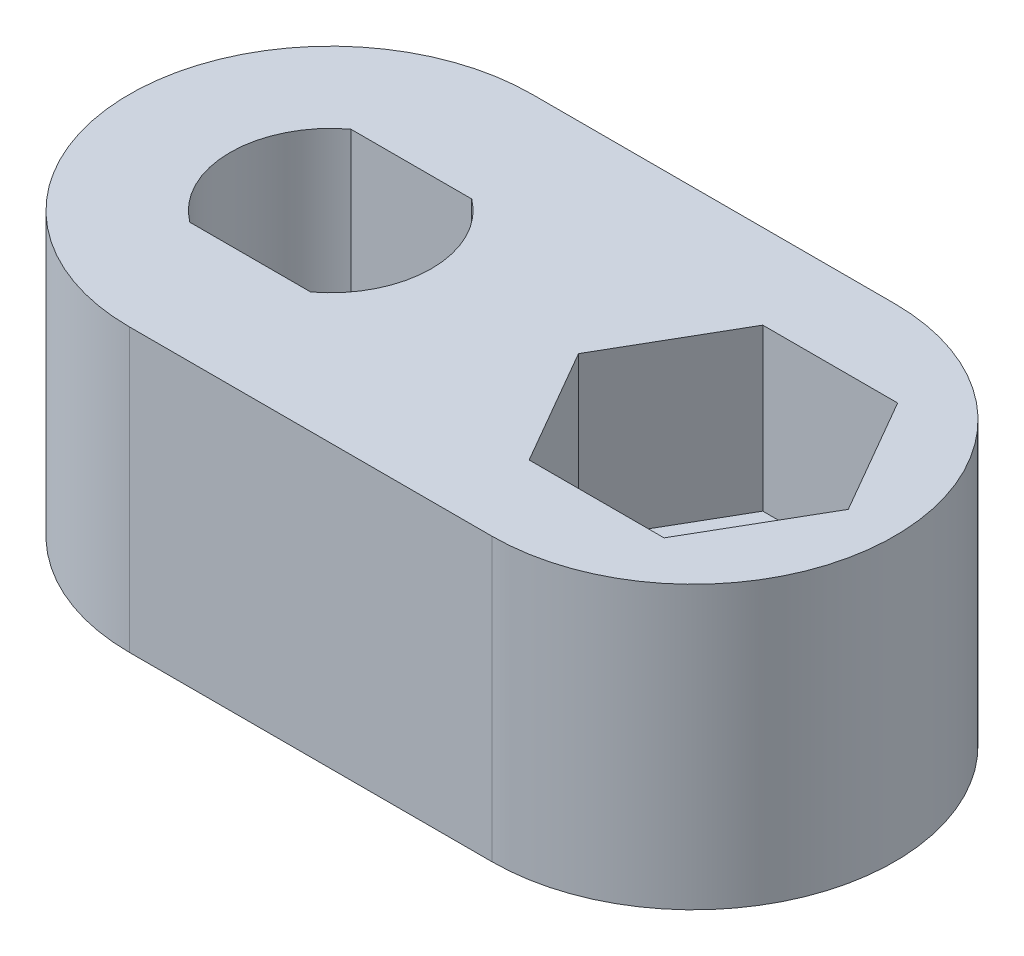
from build123d import *

# Parameters (mm, degrees)
EXTRUDE_1_DEPTH              = 7
CUT_EXTRUDE_1_DEPTH          = 4
HOLE_WIZARD_M3_1_D           = 3.4
HOLE_WIZARD_M3_1_DEPTH       = 7.5
HOLE_WIZARD_M3_1_CSINK_D     = 6.72
HOLE_WIZARD_M3_1_CSINK_ANGLE = 90
HOLE_WIZARD_M3_1_TIP         = 1.021463052
HOLE_WIZARD_1_D              = 4.15
CUT_EXTRUDE_2_DEPTH          = 4


with BuildPart() as part:
    # 草图1 → 凸台-拉伸1 (new body)
    with BuildSketch(Plane(origin=(0, 0, 0), x_dir=(1, 0, 0), z_dir=(0, 1, 0))):
        with BuildLine():
            Line((-4.5, 5), (4.5, 5))
            ThreePointArc((4.5, 5), (9.5, 0), (4.5, -5))
            Line((4.5, -5), (-4.5, -5))
            ThreePointArc((-4.5, -5), (-9.5, 0), (-4.5, 5))
        make_face()
    extrude(amount=EXTRUDE_1_DEPTH)

    # 草图2 → 切除-拉伸1 (cut)
    with BuildSketch(Plane(origin=(0, 7, 0), x_dir=(1, 0, 0), z_dir=(0, 1, 0))):
        with BuildLine():
            Line((-3, 2), (-6, 2))
            ThreePointArc((-6, 2), (-7, 0), (-6, -2))
            Line((-6, -2), (-3, -2))
            ThreePointArc((-3, -2), (-2.263932023, -1.118033989), (-2, 0))
            ThreePointArc((-2, 0), (-2.263932023, 1.118033989), (-3, 2))
        make_face()
    extrude(amount=-CUT_EXTRUDE_1_DEPTH, mode=Mode.SUBTRACT)

    # M3 六角凹锥坑螺钉的锥形沉头孔1
    with Locations(Plane(origin=(0, 0, 0), x_dir=(-1, 0, 0), z_dir=(0, -1, 0))):
        with Locations((4.5, 0)):
            CounterSinkHole(HOLE_WIZARD_M3_1_D / 2, HOLE_WIZARD_M3_1_CSINK_D / 2, depth=HOLE_WIZARD_M3_1_DEPTH, counter_sink_angle=HOLE_WIZARD_M3_1_CSINK_ANGLE)
            with Locations((0, 0, -(HOLE_WIZARD_M3_1_DEPTH + HOLE_WIZARD_M3_1_TIP / 2))):  # 118° drill point
                Cone(0, HOLE_WIZARD_M3_1_D / 2, HOLE_WIZARD_M3_1_TIP, mode=Mode.SUBTRACT)

    # 孔1 (through all)
    with Locations(Plane(origin=(0, 7, 0), x_dir=(1, 0, 0), z_dir=(0, 1, 0))):
        with Locations((5, 0)):
            Hole(HOLE_WIZARD_1_D / 2)

    # 草图12 → 切除-拉伸2 (cut)
    with BuildSketch(Plane(origin=(0, 7, 0), x_dir=(1, 0, 0), z_dir=(0, 1, 0))):
        Polygon((8.348631561, 0), (6.674315781, 2.9), (3.325684219, 2.9), (1.651368439, 0), (3.325684219, -2.9), (6.674315781, -2.9), align=None)
    extrude(amount=-CUT_EXTRUDE_2_DEPTH, mode=Mode.SUBTRACT)


solid = part.part
